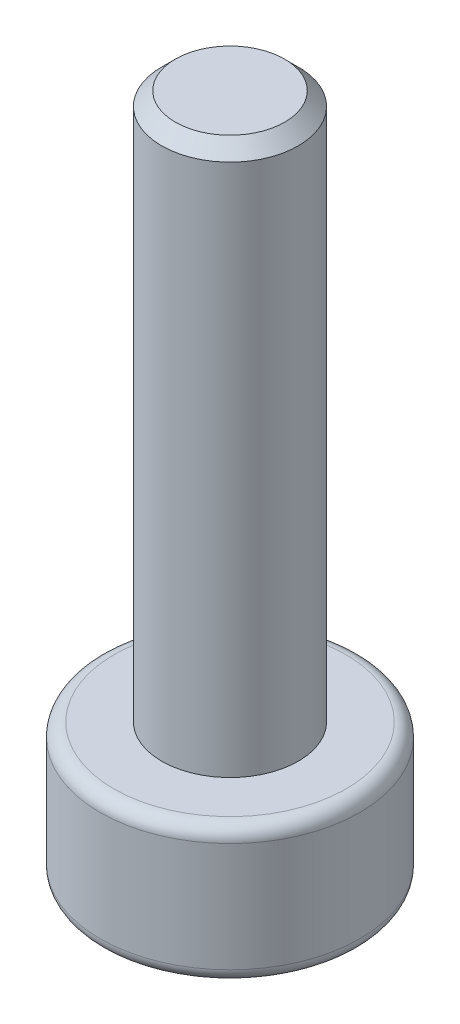
from build123d import *

# Parameters (mm, degrees)
SKETCH_1_R          = 2.85
EXTRUDE_1_DEPTH     = 3
SKETCH_2_R          = 1.5
EXTRUDE_2_DEPTH     = 12
SKETCH_3_R          = 1.29
CUT_EXTRUDE_1_DEPTH = 1.3
FILLET_1_R          = 0.3
CHAMFER_1_SIZE      = 0.3
CHAMFER_2_SIZE      = 0.15


with BuildPart() as part:
    # 草图1 → 凸台-拉伸1 (new body)
    with BuildSketch(Plane(origin=(0, 0, 0), x_dir=(1, 0, 0), z_dir=(0, 1, 0))):
        with Locations(Location((0, 0, 0), (0, 0, 270))):
            Circle(SKETCH_1_R)
    extrude(amount=EXTRUDE_1_DEPTH)

    # 草图2 → 凸台-拉伸2 (add)
    with BuildSketch(Plane(origin=(0, 3, 0), x_dir=(1, 0, 0), z_dir=(0, 1, 0))):
        with Locations(Location((0, 0, 0), (0, 0, 270))):
            Circle(SKETCH_2_R)
    extrude(amount=EXTRUDE_2_DEPTH)

    # 草图3 → 切除-拉伸1 (cut)
    with BuildSketch(Plane.XZ):
        with Locations(Location((0, 0, 0), (0, 0, 270))):
            Circle(SKETCH_3_R)
    extrude(amount=-CUT_EXTRUDE_1_DEPTH, mode=Mode.SUBTRACT)

    # 圆角1
    fillet_1_edges = [part.edges().sort_by_distance(p)[0] for p in [
        (0, 0, -2.85),
        (0, 3, -2.85),
    ]]
    fillet(fillet_1_edges, radius=FILLET_1_R)

    # 倒角1
    chamfer_1_edges = [part.edges().sort_by_distance(p)[0] for p in [
        (0, 15, -1.5),
    ]]
    chamfer(chamfer_1_edges, length=CHAMFER_1_SIZE)

    # 倒角2
    chamfer_2_edges = [part.edges().sort_by_distance(p)[0] for p in [
        (0, 0, 1.29),
    ]]
    chamfer(chamfer_2_edges, length=CHAMFER_2_SIZE)


solid = part.part
